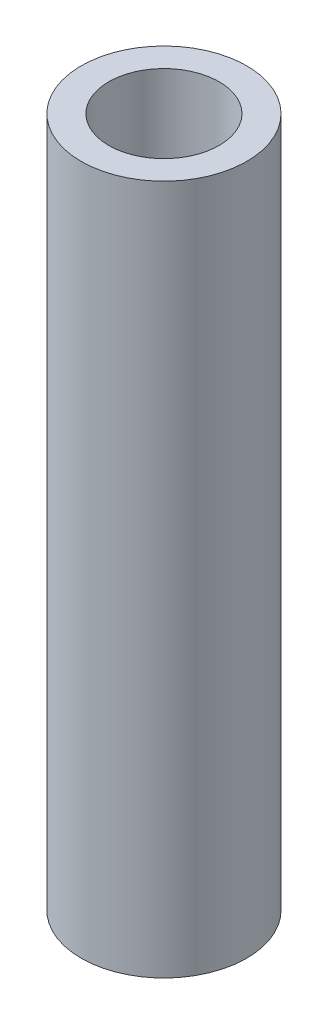
from build123d import *

# Parameters (mm, degrees)
SKETCH1_R           = 3
SKETCH1_R_2         = 2
BOSS_EXTRUDE1_DEPTH = 25


with BuildPart() as part:
    # Sketch1 → Boss-Extrude1 (new body)
    with BuildSketch(Plane(origin=(0, 0, 0), x_dir=(1, 0, 0), z_dir=(0, 1, 0))):
        with Locations(Location((0, 0, 0), (0, 0, 270))):
            Circle(SKETCH1_R)
        with Locations(Location((0, 0, 0), (0, 0, 270))):
            Circle(SKETCH1_R_2, mode=Mode.SUBTRACT)
    extrude(amount=BOSS_EXTRUDE1_DEPTH)


solid = part.part
